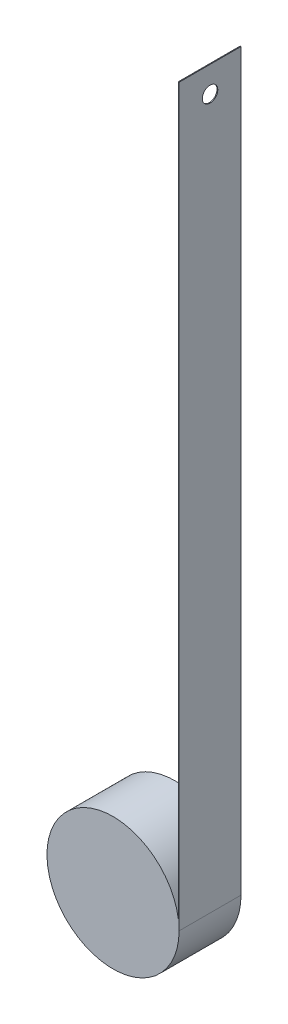
from build123d import *

# Parameters (mm, degrees)
EXTRUDE1_DEPTH     = 19.05
SKETCH2_R          = 2.38125
CUT_EXTRUDE1_DEPTH = 0.254


with BuildPart() as part:
    # Sketch1 → Extrude1 (new body)
    with BuildSketch(Plane.XY):
        with BuildLine():
            Line((20.32, 0), (20.32, 226.06))
            Line((20.32, 226.06), (20.066, 226.06))
            Line((20.066, 226.06), (20.066, 3.202818134))
            ThreePointArc((20.066, 3.202818134), (-20.25640047, -1.606437051), (20.32, 0))
        make_face()
    extrude(amount=EXTRUDE1_DEPTH)

    # Sketch2 → Cut-Extrude1 (cut)
    with BuildSketch(Plane(origin=(20.32, 0, 0), x_dir=(0, 0, -1), z_dir=(1, 0, 0))):
        with Locations(Location((-9.525, 218.1225, 0), (0, 0, 90))):
            Circle(SKETCH2_R)
    extrude(amount=-CUT_EXTRUDE1_DEPTH, mode=Mode.SUBTRACT)


solid = part.part
